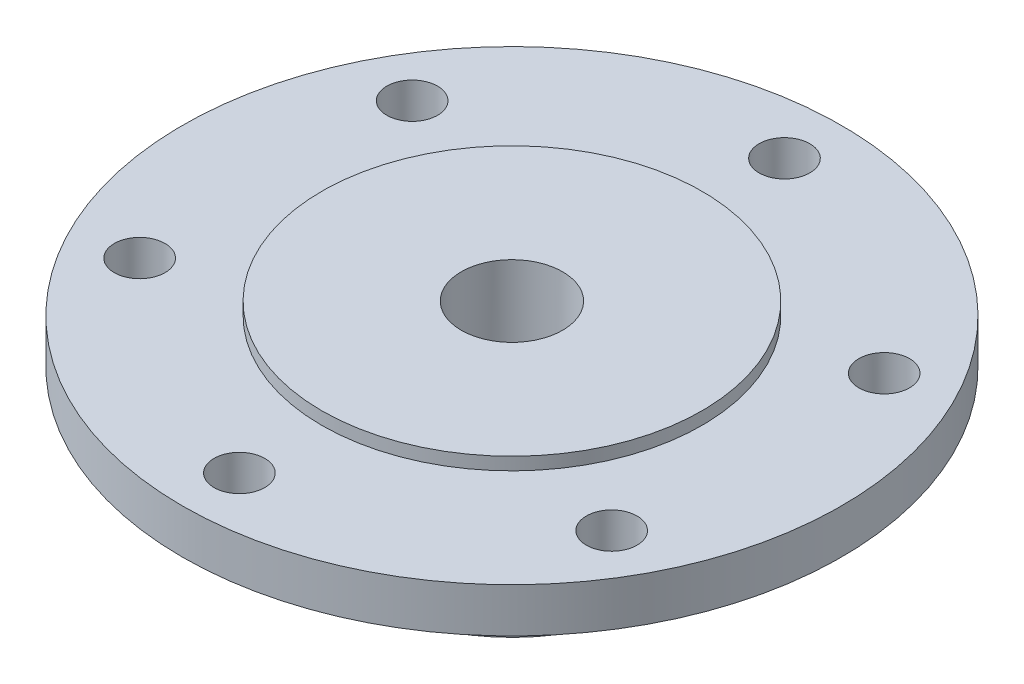
from build123d import *

# Parameters (mm, degrees)
TAP_DRILL_FOR_M12X1_25_TAP1_D     = 12
TAP_DRILL_FOR_M12X1_25_TAP1_DEPTH = 7.394836286
TAP_DRILL_FOR_M12X1_25_TAP1_TIP   = 3.605163714
SKETCH5_R                         = 4
CUT_EXTRUDE1_DEPTH                = 40.525308348
CUT_EXTRUDE2_DEPTH                = 39.105117767
CUT_EXTRUDE2_DEPTH_BACK           = 39.105117767
SKETCH6_R                         = 2


with BuildPart() as part:
    # Sketch1 → Revolve1 (revolve)
    with BuildSketch(Plane.XY, mode=Mode.PRIVATE) as revolve1_sk:
        Polygon((0, 7.25), (0, -7.25), (12, -7.25), (12, 2.75), (26, 2.75), (26, 6.25), (15, 6.25), (15, 7.25), align=None)
    revolve(revolve1_sk.sketch.rotate(Axis((0, 11.233516484, 0), (0, -1, 0)), 90), axis=Axis((0, 11.233516484, 0), (0, -1, 0)))

    # Tap Drill for M12x1.25 Tap1
    with Locations(Plane(origin=(0, -7.25, 0), x_dir=(-1, 0, 0), z_dir=(0, -1, 0))):
        with Locations((0, 0)):
            Hole(TAP_DRILL_FOR_M12X1_25_TAP1_D / 2, depth=TAP_DRILL_FOR_M12X1_25_TAP1_DEPTH)
            with Locations((0, 0, -(TAP_DRILL_FOR_M12X1_25_TAP1_DEPTH + TAP_DRILL_FOR_M12X1_25_TAP1_TIP / 2))):  # 118° drill point
                Cone(0, TAP_DRILL_FOR_M12X1_25_TAP1_D / 2, TAP_DRILL_FOR_M12X1_25_TAP1_TIP, mode=Mode.SUBTRACT)

    # Sketch5 → Cut-Extrude1 (cut, through all)
    with BuildSketch(Plane(origin=(0, 7.25, 0), x_dir=(1, 0, 0), z_dir=(0, 1, 0))):
        with Locations(Location((0, 0, 0), (0, 0, 270))):
            Circle(SKETCH5_R)
    extrude(amount=-CUT_EXTRUDE1_DEPTH, mode=Mode.SUBTRACT)

    # Sketch6 → Cut-Extrude2 (cut, two sides: drawn at the far end of the back side and taken through both)
    with BuildSketch(Plane.XZ.offset(-2.75).offset(-CUT_EXTRUDE2_DEPTH_BACK)):
        with Locations(Location((-18.619546181, 10.75, 0), (0, 0, 270))):
            Circle(SKETCH6_R)
        with Locations(Location((0, 21.5, 0), (0, 0, 270))):
            Circle(SKETCH6_R)
        with Locations(Location((18.619546181, 10.75, 0), (0, 0, 270))):
            Circle(SKETCH6_R)
        with Locations(Location((18.619546181, -10.75, 0), (0, 0, 270))):
            Circle(SKETCH6_R)
        with Locations(Location((0, -21.5, 0), (0, 0, 270))):
            Circle(SKETCH6_R)
        with Locations(Location((-18.619546181, -10.75, 0), (0, 0, 270))):
            Circle(SKETCH6_R)
    extrude(amount=CUT_EXTRUDE2_DEPTH + CUT_EXTRUDE2_DEPTH_BACK, mode=Mode.SUBTRACT)


solid = part.part
